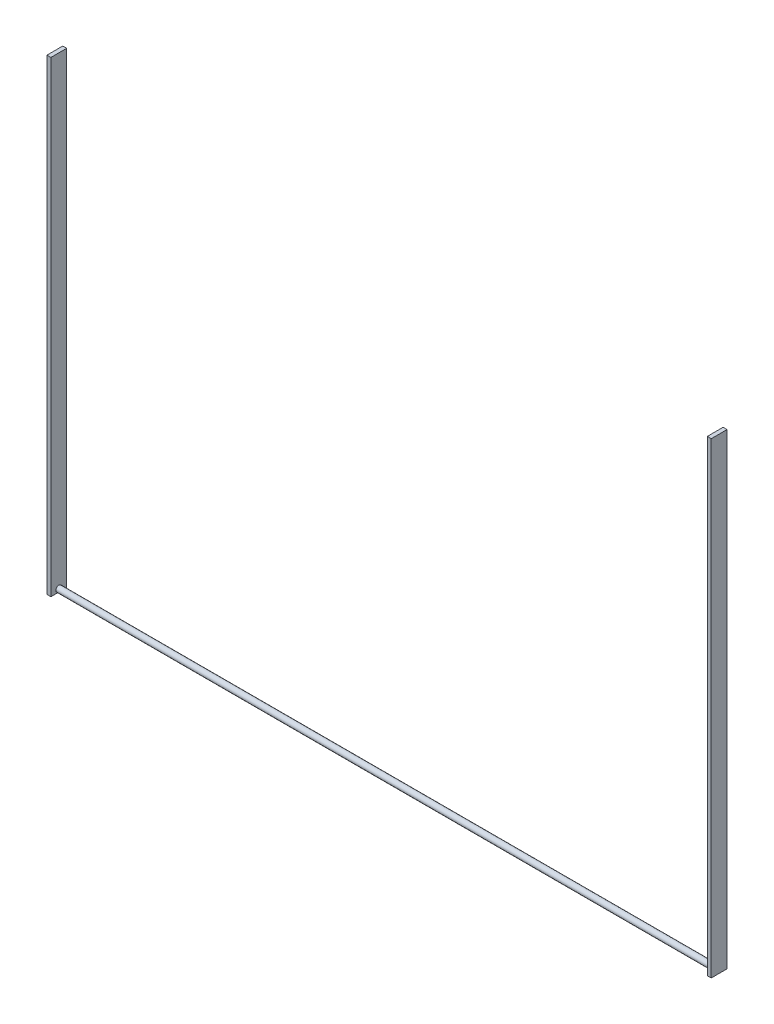
from build123d import *

# Parameters (mm, degrees)
CROQUIS1_W                = 6.35
CROQUIS1_H                = 750
SALIENTE_EXTRUIR1_DEPTH   = 25.4
SALIENTE_EXTRUIR1_2_DEPTH = 25.4
CROQUIS2_R                = 4.7625
SALIENTE_EXTRUIR2_DEPTH   = 1054


with BuildPart() as part:
    # Croquis1 → Saliente-Extruir1 (new body)
    with BuildSketch(Plane.XY):
        with Locations((3.175, 375)):
            Rectangle(CROQUIS1_W, CROQUIS1_H)
    extrude(amount=SALIENTE_EXTRUIR1_DEPTH)



with BuildPart() as body_2:
    # Croquis1 → Saliente-Extruir1 2 (new body)
    with BuildSketch(Plane.XY):
        with Locations((1063.525, 375)):
            Rectangle(CROQUIS1_W, CROQUIS1_H)
    extrude(amount=SALIENTE_EXTRUIR1_2_DEPTH)


with BuildPart() as part_1:
    add(part.part)

    add(body_2.part)  # Saliente-Extruir2 merges body 2
    # Croquis2 → Saliente-Extruir2 (add)
    with BuildSketch(Plane(origin=(6.35, 0, 0), x_dir=(0, 0, -1), z_dir=(1, 0, 0))):
        with Locations(Location((-12.7, 5, 0), (0, 0, 270))):
            Circle(CROQUIS2_R)
    extrude(amount=SALIENTE_EXTRUIR2_DEPTH)


solid = part_1.part
